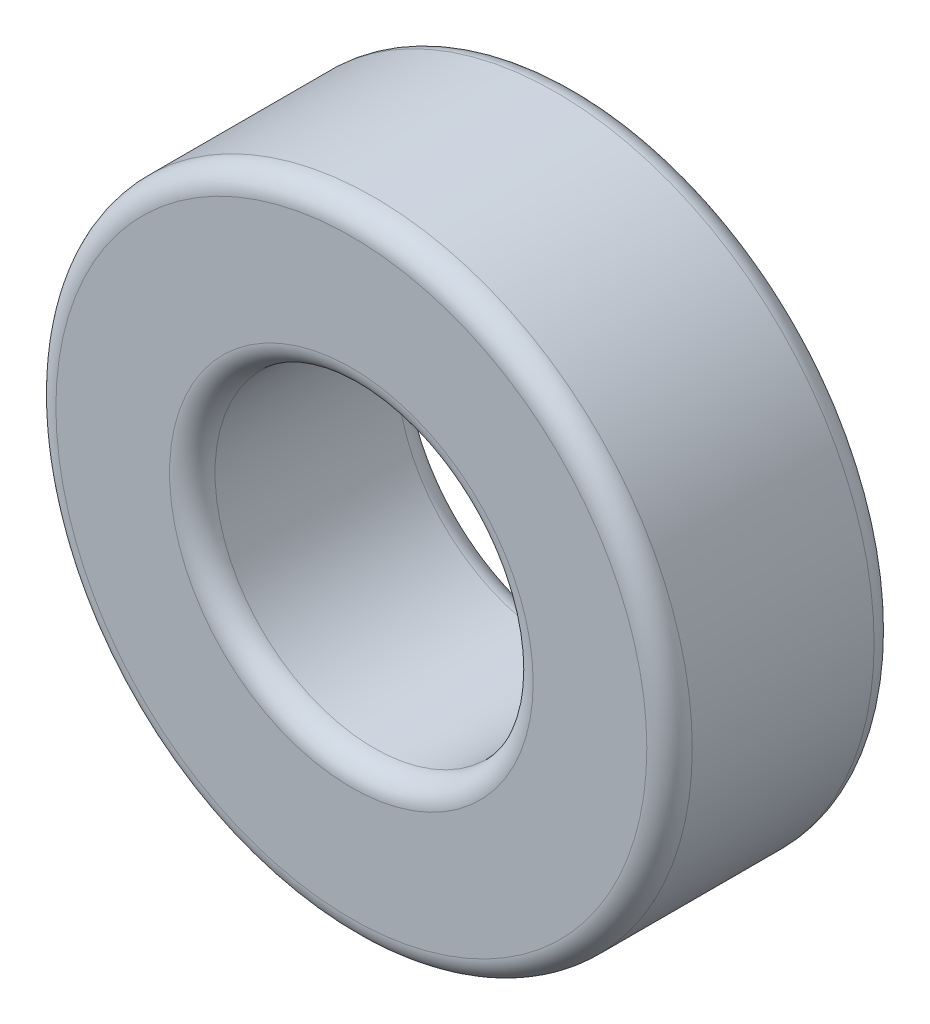
from build123d import *

# Parameters (mm, degrees)
ESQUISSE1_R        = 7
ESQUISSE1_R_2      = 3.5
BOSS_EXTRU_1_DEPTH = 5
CONG_1_R           = 0.5


with BuildPart() as part:
    # Esquisse1 → Boss.-Extru.1 (new body)
    with BuildSketch(Plane.XY):
        Circle(ESQUISSE1_R)
        Circle(ESQUISSE1_R_2, mode=Mode.SUBTRACT)
    extrude(amount=BOSS_EXTRU_1_DEPTH)

    # Congé1
    cong_1_edges = [part.edges().sort_by_distance(p)[0] for p in [
        (-7, 0, 0),
        (-7, 0, 5),
        (-3.5, 0, 0),
        (-3.5, 0, 5),
    ]]
    fillet(cong_1_edges, radius=CONG_1_R)


solid = part.part
